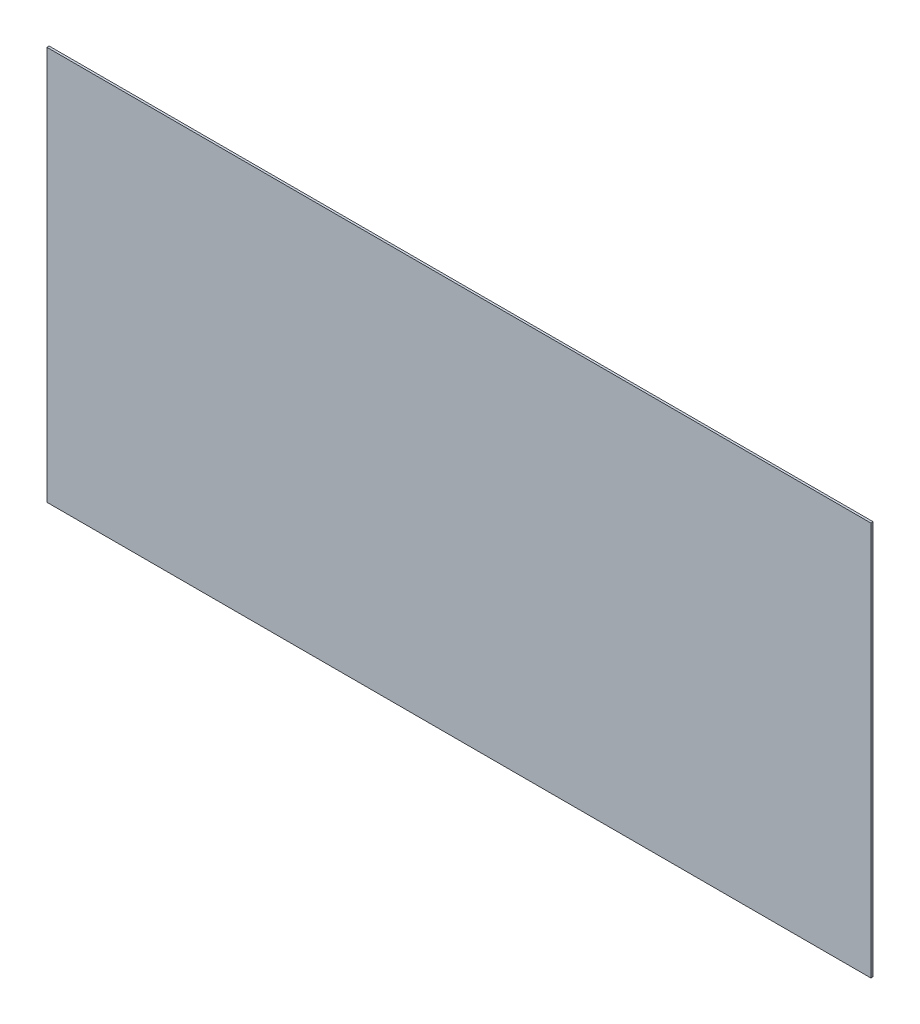
from build123d import *

# Parameters (mm, degrees)
SKETCH1_W           = 584.2
SKETCH1_H           = 279.4
BOSS_EXTRUDE1_DEPTH = 1.5875


with BuildPart() as part:
    # Sketch1 → Boss-Extrude1 (new body)
    with BuildSketch(Plane.XY):
        with Locations((292.1, 139.7)):
            Rectangle(SKETCH1_W, SKETCH1_H)
    extrude(amount=BOSS_EXTRUDE1_DEPTH)


solid = part.part
